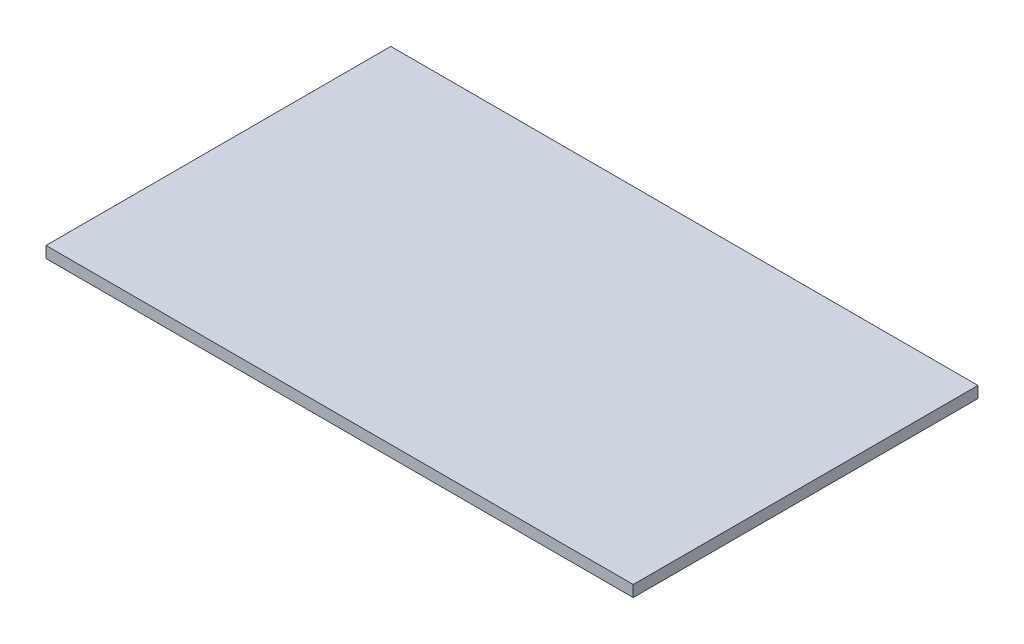
from build123d import *

# Parameters (mm, degrees)
SKETCH1_W           = 984.25
SKETCH1_H           = 577.85
BOSS_EXTRUDE1_DEPTH = 19.05


with BuildPart() as part:
    # Sketch1 → Boss-Extrude1 (new body)
    with BuildSketch(Plane(origin=(0, 0, 0), x_dir=(1, 0, 0), z_dir=(0, 1, 0))):
        with Locations((492.125, 288.925)):
            Rectangle(SKETCH1_W, SKETCH1_H)
    extrude(amount=BOSS_EXTRUDE1_DEPTH)


solid = part.part
